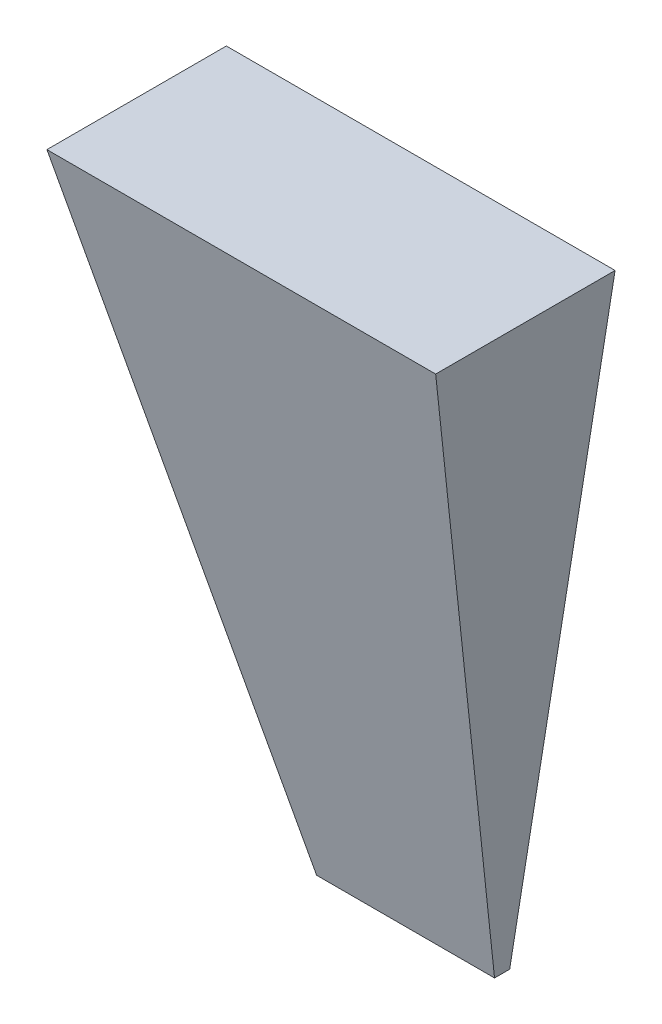
from build123d import *

# Parameters (mm, degrees)
SKETCH_1_W          = 6.5
SKETCH_1_H          = 11
EXTRUDE_1_DEPTH     = 3
CUT_EXTRUDE_1_DEPTH = 10
CUT_EXTRUDE_2_DEPTH = 10


with BuildPart() as part:
    # 草图1 → 凸台-拉伸1 (new body)
    with BuildSketch(Plane.XY):
        with Locations((3.25, -5.5)):
            Rectangle(SKETCH_1_W, SKETCH_1_H)
    extrude(amount=EXTRUDE_1_DEPTH)

    # 草图2 → 切除-拉伸1 (cut)
    with BuildSketch(Plane(origin=(6.5, 0, 0), x_dir=(0, 0, -1), z_dir=(1, 0, 0))):
        Polygon((-3, 0), (-0.252978195, -11), (-3, -11), align=None)
    extrude(amount=-CUT_EXTRUDE_1_DEPTH, mode=Mode.SUBTRACT)

    # 草图3 → 切除-拉伸2 (cut)
    with BuildSketch(Plane(origin=(0, 0, 0), x_dir=(-1, 0, 0), z_dir=(0, 0, -1))):
        Polygon((-6.5, 0), (-4.73741155, -11), (-6.5, -11), align=None)
        Polygon((-1.76258845, -11), (0, -11), (0, 0), align=None)
    extrude(amount=-CUT_EXTRUDE_2_DEPTH, mode=Mode.SUBTRACT)


solid = part.part
